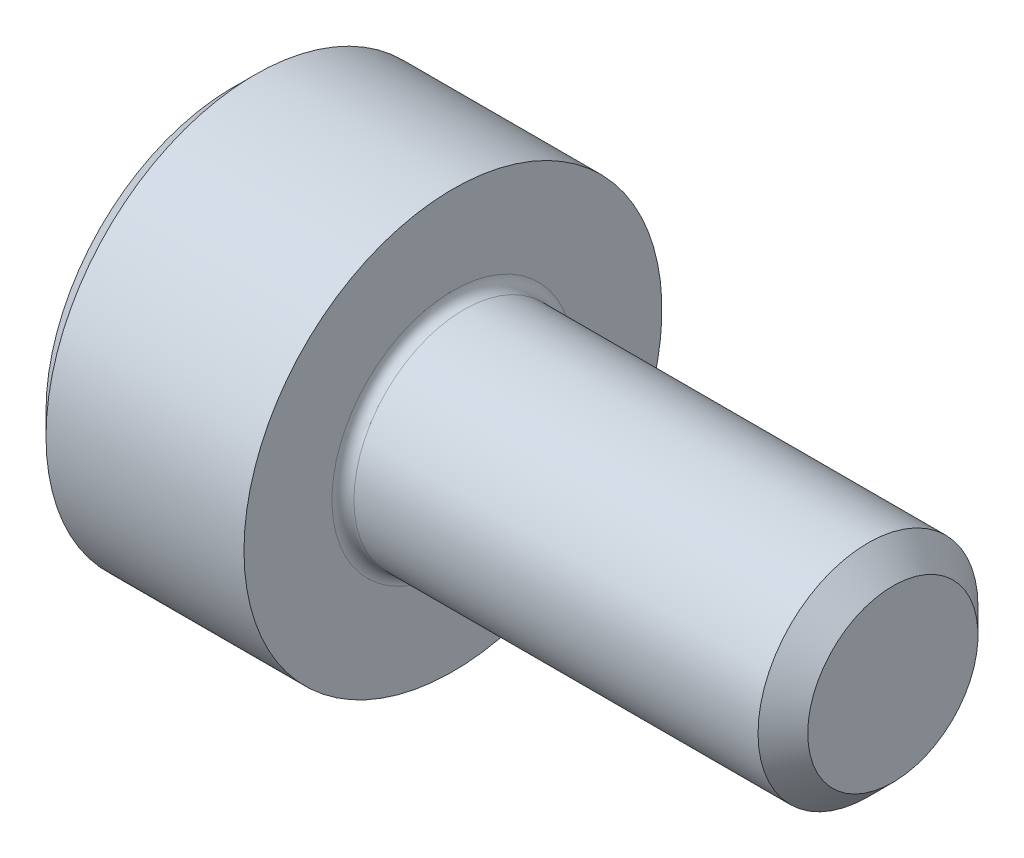
from build123d import *

# Parameters (mm, degrees)
FILLET1_R   = 0.1
HEX_2_DEPTH = 1


with BuildPart() as part:
    # BodySke → Base-Revolve (revolve)
    with BuildSketch(Plane.XY, mode=Mode.PRIVATE) as base_revolve_sk:
        Polygon((0, 0), (0, 1.7), (0.2, 1.9), (2, 1.9), (2, 1), (5.774, 1), (6, 0.774), (6, 0), align=None)
    revolve(base_revolve_sk.sketch.rotate(Axis((-31.75, 0, 0), (1, 0, 0)), 90), axis=Axis((-31.75, 0, 0), (1, 0, 0)))

    # Fillet1
    fillet1_edges = [part.edges().sort_by_distance(p)[0] for p in [
        (2, 0, -1),
    ]]
    fillet(fillet1_edges, radius=FILLET1_R)

    # Sketch2 → Hex-PreBroach (revolve, cut)
    with BuildSketch(Plane.XY, mode=Mode.PRIVATE) as hex_prebroach_sk:
        Polygon((0, 0.7725), (1, 0.7725), (1.446003083, 0), (0, 0), align=None)
    revolve(hex_prebroach_sk.sketch.rotate(Axis((0, 0, 0), (1, 0, 0)), 90), axis=Axis((0, 0, 0), (1, 0, 0)), mode=Mode.SUBTRACT)

    # Sketch3 → Hex 2 (cut)
    with BuildSketch(Plane(origin=(0, 0, 0), x_dir=(0, 0.500000000000001, 0.866025403784438), z_dir=(-1, 0, 0))):
        Polygon((0.446003083, 0.7725), (-0.446003083, 0.7725), (-0.892006166, 0), (-0.446003083, -0.7725), (0.446003083, -0.7725), (0.892006166, 0), align=None)
    extrude(amount=-HEX_2_DEPTH, mode=Mode.SUBTRACT)


solid = part.part
